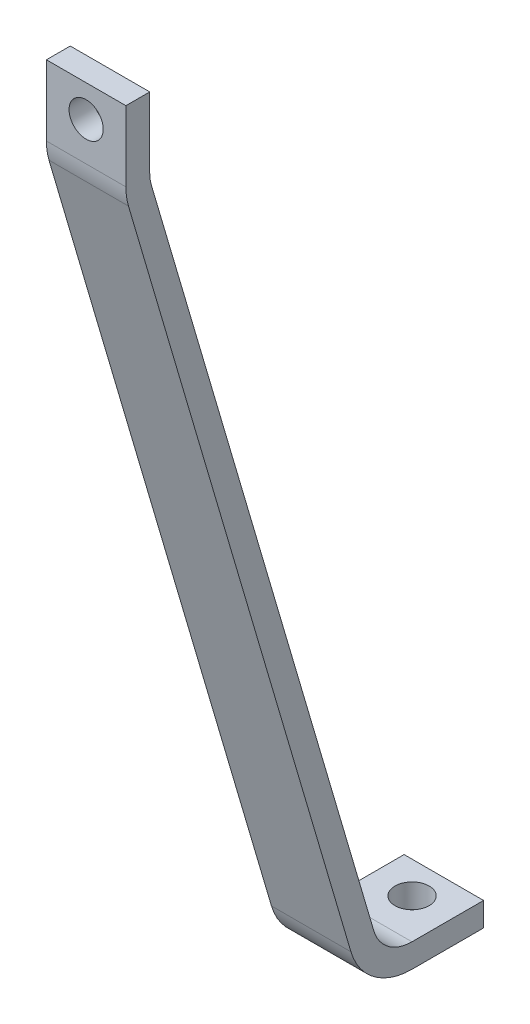
from build123d import *

# Parameters (mm, degrees)
EXTRUDE_1_DEPTH    = 5
HOLE_WIZARD_M4_1_D = 4.3
HOLE_WIZARD_M4_2_D = 4.3


with BuildPart() as part:
    # 草图1 → 拉伸-薄壁1 (new, symmetric)
    with BuildSketch(Plane(origin=(0, 0, 0), x_dir=(0, 0, -1), z_dir=(1, 0, 0))):
        with BuildLine():
            Line((0, 112.09), (0, 103.241097815))
            ThreePointArc((0, 103.241097815), (0.081550018, 102.101734006), (0.324537472, 100.985598982))
            Line((0.324537472, 100.985598982), (28.311930306, 5.744501167))
            ThreePointArc((28.311930306, 5.744501167), (31.193855031, 1.595158446), (35.987392834, 0))
            Line((35.987392834, 0), (45, 0))
            Line((45, 0), (45, 3))
            Line((45, 3), (35.987392834, 3))
            ThreePointArc((35.987392834, 3), (32.991431707, 3.996974029), (31.190228754, 6.59031323))
            Line((31.190228754, 6.59031323), (3.20283592, 101.831411044))
            ThreePointArc((3.20283592, 101.831411044), (3.050968761, 102.528995434), (3, 103.241097815))
            Line((3, 103.241097815), (3, 112.09))
            Line((3, 112.09), (0, 112.09))
        make_face()
    extrude(amount=EXTRUDE_1_DEPTH, both=True)

    # M4 间隙孔1 (through all)
    with Locations(Plane(origin=(0, 0, -3), x_dir=(-1, 0, 0), z_dir=(0, 0, -1))):
        with Locations((0, 108.09)):
            Hole(HOLE_WIZARD_M4_1_D / 2)

    # M4 间隙孔2 (through all)
    with Locations(Plane(origin=(0, 0, 0), x_dir=(-1, 0, 0), z_dir=(0, -1, 0))):
        with Locations((0, 41)):
            Hole(HOLE_WIZARD_M4_2_D / 2)


solid = part.part
